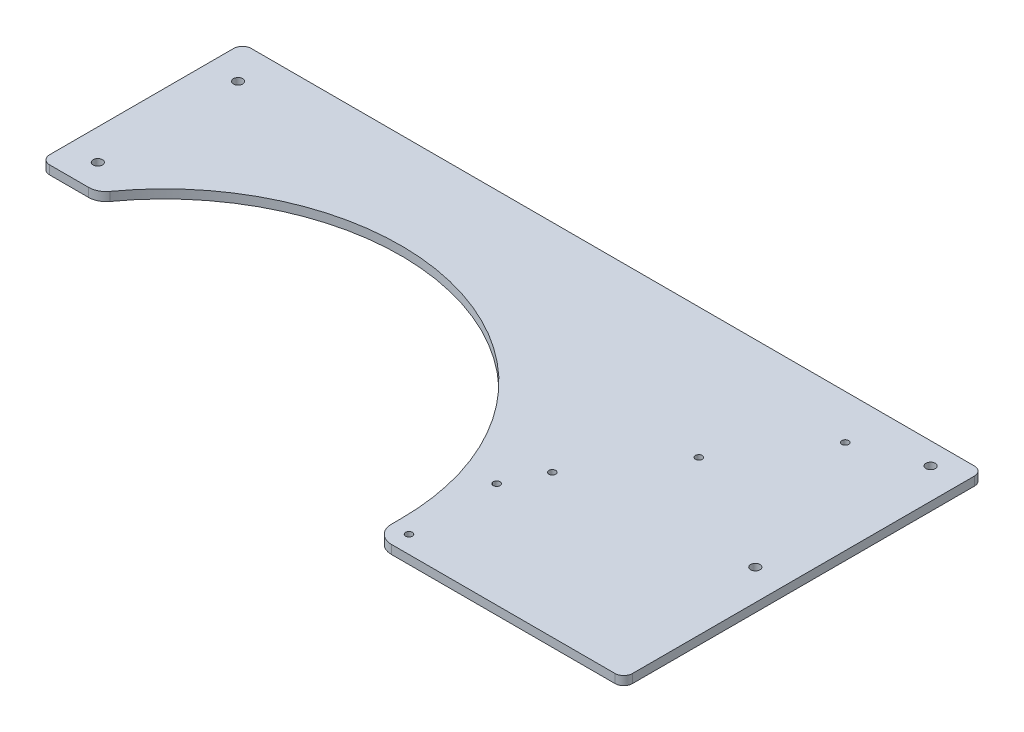
from build123d import *

# Parameters (mm, degrees)
BOSS_EXTRUDE1_DEPTH              = 6.35
F_17_64_0_26563_DIAMETER_HOLE1_D = 6.747002
FILLET1_R                        = 6.35
F_10_0_1935_DIAMETER_HOLE1_D     = 4.9149
SKETCH8_R                        = 3.373501
CUT_EXTRUDE1_DEPTH               = 299.268395545
FILLET2_R                        = 12.7


with BuildPart() as part:
    # Sketch1 → Boss-Extrude1 (new body)
    with BuildSketch(Plane(origin=(0, 0, 0), x_dir=(1, 0, 0), z_dir=(0, 1, 0))):
        with BuildLine():
            Line((-268.2875, -15.875), (-233.3625, -15.875))
            ThreePointArc((-233.3625, -15.875), (-228.872371939, -17.734871939), (-227.0125, -22.225))
            Line((-227.0125, -22.225), (-227.0125, -130.175))
            Line((-227.0125, -130.175), (268.2875, -130.175))
            Line((268.2875, -130.175), (268.2875, 130.175))
            Line((268.2875, 130.175), (-268.2875, 130.175))
            Line((-268.2875, 130.175), (-268.2875, -15.875))
        make_face()
    extrude(amount=BOSS_EXTRUDE1_DEPTH)

    # 17/64 (0.26563) Diameter Hole1 (through all)
    with Locations(Plane(origin=(0, 6.35, 0), x_dir=(1, 0, 0), z_dir=(0, 1, 0))):
        with Locations((-246.0625, 104.775), (-246.0625, 3.175), (-220.6625, -53.975), (-220.6625, -117.475), (246.0625, 114.3381), (246.0625, -12.6619)):
            Hole(F_17_64_0_26563_DIAMETER_HOLE1_D / 2)

    # Fillet1
    fillet1_edges = [part.edges().sort_by_distance(p)[0] for p in [
        (268.2875, 3.175, 130.175),
        (-227.0125, 3.175, 130.175),
        (-268.2875, 3.175, 15.875),
        (-268.2875, 3.175, -130.175),
        (268.2875, 3.175, -130.175),
    ]]
    fillet(fillet1_edges, radius=FILLET1_R)

    # #10 (0.1935) Diameter Hole1 (through all)
    with Locations(Plane(origin=(0, 6.35, 0), x_dir=(1, 0, 0), z_dir=(0, 1, 0))):
        with Locations((200.4455889, 98.15353155), (156.73906445, 35.734145775), (113.03254, -26.68524), (100.0125, -53.975), (100.0125, -117.475)):
            Hole(F_10_0_1935_DIAMETER_HOLE1_D / 2)

    # Sketch8 → Cut-Extrude1 (cut, through all)
    with BuildSketch(Plane(origin=(0, 6.35, 0), x_dir=(1, 0, 0), z_dir=(0, 1, 0))):
        with BuildLine():
            Line((-220.6625, -130.175), (87.3125, -130.175))
            Line((87.3125, -130.175), (87.3125, -110.647553384))
            ThreePointArc((87.3125, -110.647553384), (-34.644148174, 53.50332424), (-227.0125, -15.875))
            Line((-227.0125, -15.875), (-233.3625, -15.875))
            ThreePointArc((-233.3625, -15.875), (-228.872371939, -17.734871939), (-227.0125, -22.225))
            Line((-227.0125, -22.225), (-227.0125, -123.825))
            ThreePointArc((-227.0125, -123.825), (-225.152628061, -128.315128061), (-220.6625, -130.175))
        make_face()
        with Locations((-220.6625, -117.475)):
            Circle(SKETCH8_R, mode=Mode.SUBTRACT)
        with Locations((-220.6625, -53.975)):
            Circle(SKETCH8_R, mode=Mode.SUBTRACT)
    extrude(amount=-CUT_EXTRUDE1_DEPTH, mode=Mode.SUBTRACT)

    # Fillet2
    fillet2_edges = [part.edges().sort_by_distance(p)[0] for p in [
        (-227.0125, 3.175, 15.875),
        (87.3125, 3.175, 130.175),
    ]]
    fillet(fillet2_edges, radius=FILLET2_R)


solid = part.part
